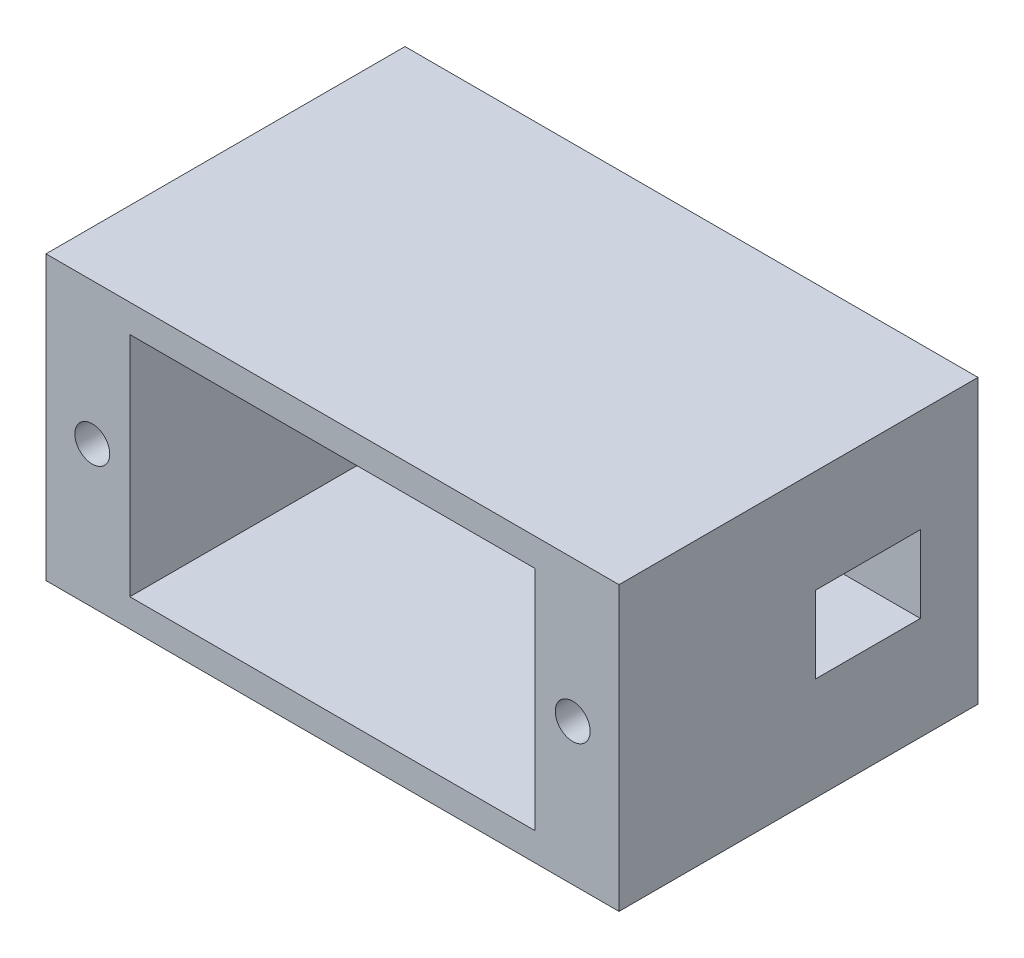
from build123d import *

# Parameters (mm, degrees)
BOSS_EXTRUDE1_START = -5.125
SKETCH1_W           = 32.8
SKETCH1_H           = 16.2
BOSS_EXTRUDE1_DEPTH = 10.275
CUT_EXTRUDE1_START  = -3.475
SKETCH2_W           = 23.2
SKETCH2_H           = 13
CUT_EXTRUDE1_DEPTH  = 8.625
CUT_EXTRUDE2_START  = 2.15
SKETCH3_R           = 1
CUT_EXTRUDE2_DEPTH  = 3
CUT_EXTRUDE3_START  = 2.15
SKETCH4_R           = 1
CUT_EXTRUDE3_DEPTH  = 3
CUT_EXTRUDE4_START  = -14.1
SKETCH5_R           = 3.15
CUT_EXTRUDE4_DEPTH  = 1.3
CUT_EXTRUDE5_START  = 14
SKETCH6_W           = 6
SKETCH6_H           = 4.4
CUT_EXTRUDE5_DEPTH  = 2.4


with BuildPart() as part:
    # Sketch1 → Boss-Extrude1 (new, symmetric)
    with BuildSketch(Plane.XY.offset(BOSS_EXTRUDE1_START)):
        Rectangle(SKETCH1_W, SKETCH1_H)
    extrude(amount=BOSS_EXTRUDE1_DEPTH, both=True)

    # Sketch2 → Cut-Extrude1 (cut, symmetric)
    with BuildSketch(Plane.XY.offset(CUT_EXTRUDE1_START)):
        Rectangle(SKETCH2_W, SKETCH2_H)
    extrude(amount=CUT_EXTRUDE1_DEPTH, both=True, mode=Mode.SUBTRACT)

    # Sketch3 → Cut-Extrude2 (cut, symmetric)
    with BuildSketch(Plane.XY.offset(CUT_EXTRUDE2_START)):
        with Locations((-13.75, 0)):
            Circle(SKETCH3_R)
    extrude(amount=CUT_EXTRUDE2_DEPTH, both=True, mode=Mode.SUBTRACT)

    # Sketch4 → Cut-Extrude3 (cut, symmetric)
    with BuildSketch(Plane.XY.offset(CUT_EXTRUDE3_START)):
        with Locations((13.75, 0)):
            Circle(SKETCH4_R)
    extrude(amount=CUT_EXTRUDE3_DEPTH, both=True, mode=Mode.SUBTRACT)

    # Sketch5 → Cut-Extrude4 (cut, symmetric)
    with BuildSketch(Plane.XY.offset(CUT_EXTRUDE4_START)):
        with Locations((5.5, 0)):
            Circle(SKETCH5_R)
    extrude(amount=CUT_EXTRUDE4_DEPTH, both=True, mode=Mode.SUBTRACT)

    # Sketch6 → Cut-Extrude5 (cut, symmetric)
    with BuildSketch(Plane(origin=(0, 0, 0), x_dir=(0, 0, -1), z_dir=(1, 0, 0)).offset(CUT_EXTRUDE5_START)):
        with Locations((9.1, 0)):
            Rectangle(SKETCH6_W, SKETCH6_H)
    extrude(amount=CUT_EXTRUDE5_DEPTH, both=True, mode=Mode.SUBTRACT)


solid = part.part
